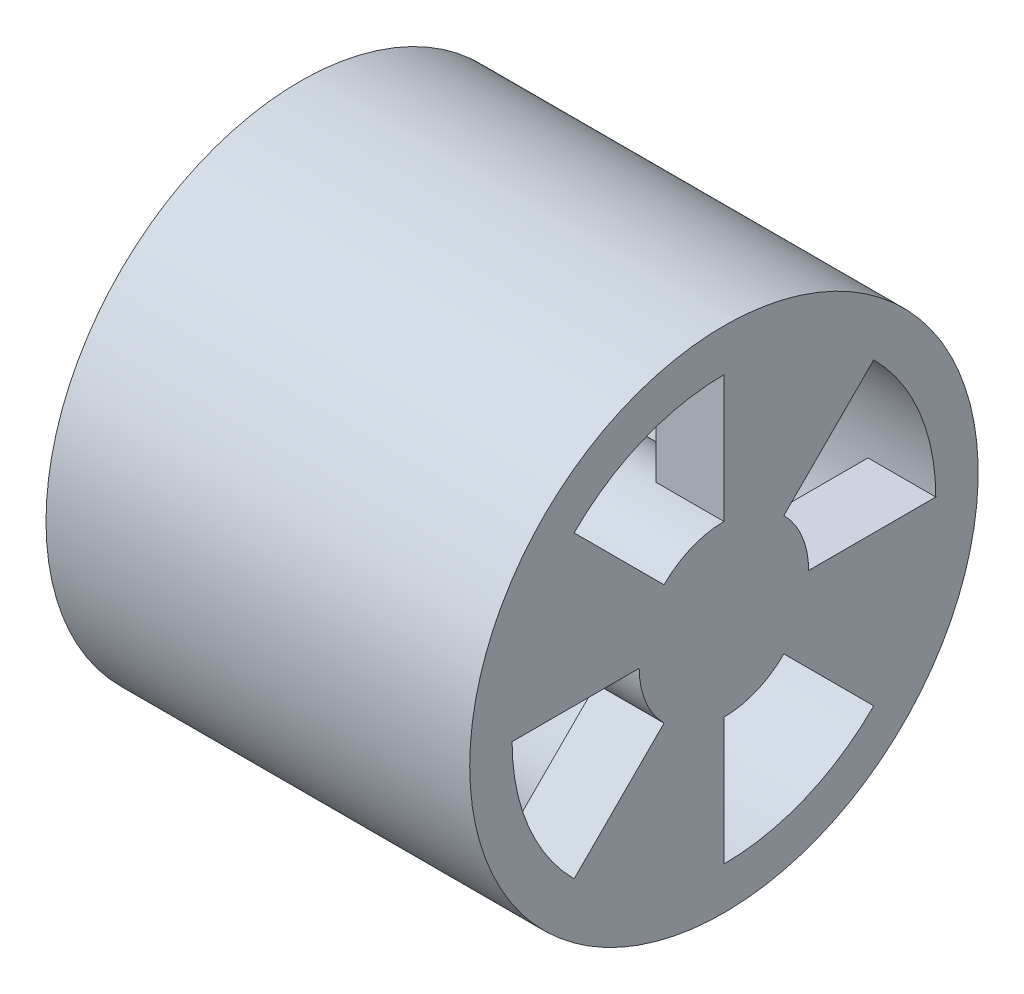
from build123d import *
from build123d.topology import SkipClean

# Parameters (mm, degrees)
SKETCH1_W          = 25
SKETCH1_H          = 2.5
SKETCH2_W          = 17
SKETCH2_H          = 12.5
CUT_EXTRUDE1_DEPTH = 10
SKETCH4_R          = 12.5
SKETCH4_R_2        = 5
CUT_EXTRUDE2_DEPTH = 13
CUT_EXTRUDE3_DEPTH = 30.849623113


with BuildPart() as part:
    # Sketch1 → Revolve1 (revolve)
    with BuildSketch(Plane.XY, mode=Mode.PRIVATE) as revolve1_sk:
        with Locations((12.5, 13.75)):
            Rectangle(SKETCH1_W, SKETCH1_H)
    revolve(revolve1_sk.sketch.rotate(Axis((0, 0, 0), (1, 0, 0)), 90), axis=Axis((0, 0, 0), (1, 0, 0)))

    # Sketch2 → Revolve2 (revolve)
    with BuildSketch(Plane.XY, mode=Mode.PRIVATE) as revolve2_sk:
        with Locations((16.5, 6.25)):
            Rectangle(SKETCH2_W, SKETCH2_H)
    revolve(revolve2_sk.sketch.rotate(Axis((0, 0, 0), (1, 0, 0)), 90), axis=Axis((0, 0, 0), (1, 0, 0)))

    # Sketch3 → Cut-Extrude1 (cut)
    with BuildSketch(Plane.ZY.offset(-8)):
        with BuildLine():
            Line((0.829156198, 1.25), (0.829156198, -1.25))
            ThreePointArc((0.829156198, -1.25), (-1.5, 0), (0.829156198, 1.25))
        make_face()
    extrude(amount=-CUT_EXTRUDE1_DEPTH, mode=Mode.SUBTRACT)

    # Sketch4 → Cut-Extrude2 (cut)
    with BuildSketch(Plane.ZY.offset(-8)):
        Circle(SKETCH4_R)
        Circle(SKETCH4_R_2, mode=Mode.SUBTRACT)
    extrude(amount=-CUT_EXTRUDE2_DEPTH, mode=Mode.SUBTRACT)

    # Sketch5 → Cut-Extrude3 (cut, through all)
    with SkipClean():  # the faces are left unmerged after this step: merging them gives an invalid solid
        with BuildSketch(Plane.ZY.offset(-21)):
            with BuildLine():
                Line((12.5, 0), (5, 0))
                ThreePointArc((5, 0), (4.619397663, -1.913417162), (3.535533906, -3.535533906))
                Line((3.535533906, -3.535533906), (8.838834765, -8.838834765))
                ThreePointArc((8.838834765, -8.838834765), (11.548494156, -4.783542905), (12.5, 0))
            make_face()
            with BuildLine():
                Line((-12.5, 0), (-5, 0))
                ThreePointArc((-5, 0), (-4.619397663, 1.913417162), (-3.535533906, 3.535533906))
                Line((-3.535533906, 3.535533906), (-8.838834765, 8.838834765))
                ThreePointArc((-8.838834765, 8.838834765), (-11.548494156, 4.783542905), (-12.5, 0))
            make_face()
            with BuildLine():
                ThreePointArc((0, 5), (1.913417162, 4.619397663), (3.535533906, 3.535533906))
                Line((3.535533906, 3.535533906), (8.838834765, 8.838834765))
                ThreePointArc((8.838834765, 8.838834765), (4.783542905, 11.548494156), (0, 12.5))
                Line((0, 12.5), (0, 5))
            make_face()
            with BuildLine():
                Line((0, -12.5), (0, -5))
                ThreePointArc((0, -5), (-1.913417162, -4.619397663), (-3.535533906, -3.535533906))
                Line((-3.535533906, -3.535533906), (-8.838834765, -8.838834765))
                ThreePointArc((-8.838834765, -8.838834765), (-4.783542905, -11.548494156), (0, -12.5))
            make_face()
        extrude(amount=-CUT_EXTRUDE3_DEPTH, mode=Mode.SUBTRACT)


solid = part.part
